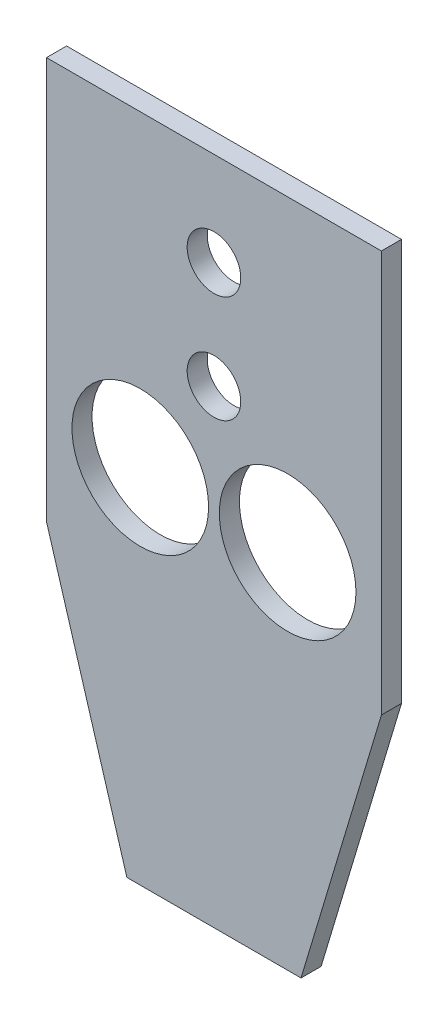
from build123d import *

# Parameters (mm, degrees)
SKETCH1_W           = 250
SKETCH1_H           = 300
SKETCH1_R           = 20
SKETCH1_R_2         = 51
BOSS_EXTRUDE1_DEPTH = 15
BOSS_EXTRUDE2_DEPTH = 15


with BuildPart() as part:
    # Sketch1 → Boss-Extrude1 (new body)
    with BuildSketch(Plane.XY):
        with Locations((-125, 150)):
            Rectangle(SKETCH1_W, SKETCH1_H)
        with Locations((-125, 230)):
            Circle(SKETCH1_R, mode=Mode.SUBTRACT)
        with Locations((-125, 150)):
            Circle(SKETCH1_R, mode=Mode.SUBTRACT)
        with Locations((-180, 70)):
            Circle(SKETCH1_R_2, mode=Mode.SUBTRACT)
        with Locations((-70, 70)):
            Circle(SKETCH1_R_2, mode=Mode.SUBTRACT)
    extrude(amount=BOSS_EXTRUDE1_DEPTH)

    # Sketch2 → Boss-Extrude2 (add)
    with BuildSketch(Plane.XY):
        Polygon((-190, 0), (-60, 0), (0, 0), (-60, -200), (-190, -200), (-250, 0), align=None)
    extrude(amount=BOSS_EXTRUDE2_DEPTH)


solid = part.part
